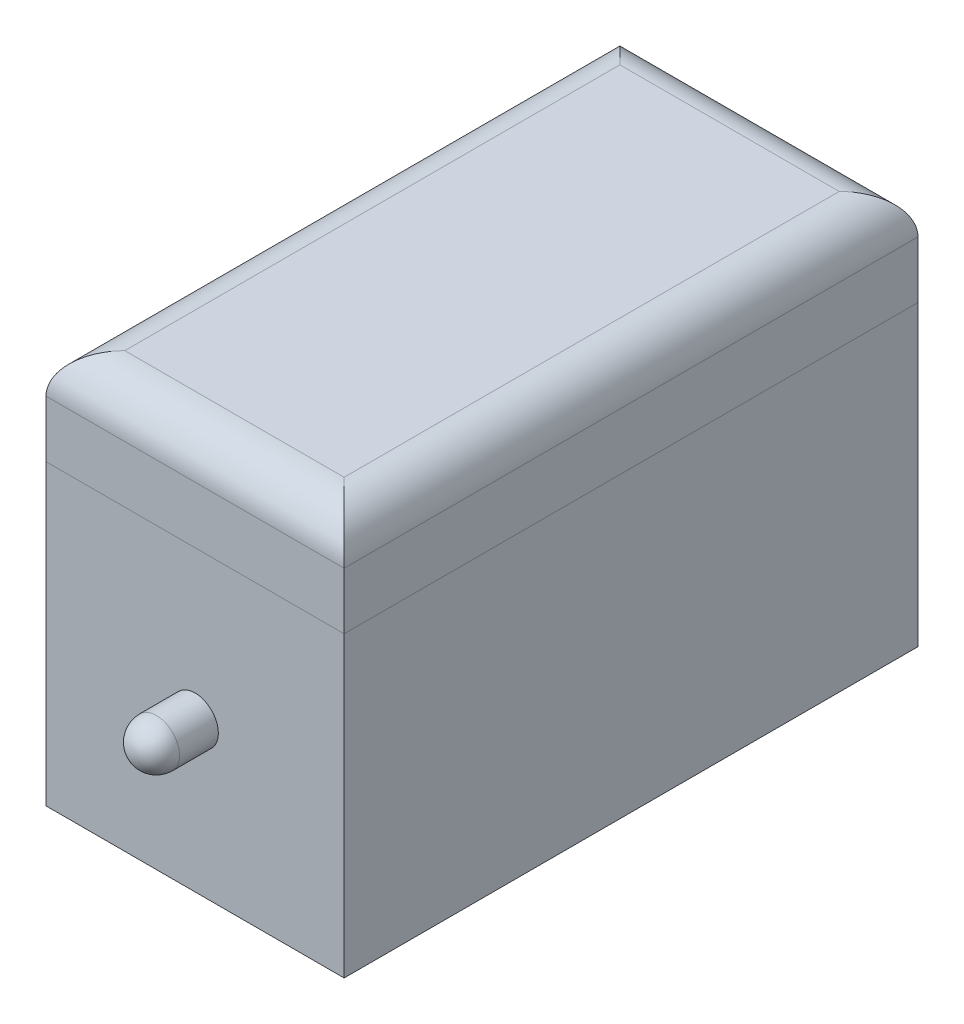
from build123d import *

# Parameters (mm, degrees)
SKETCH1_W           = 19.22
SKETCH1_H           = 19.22
BOSS_EXTRUDE1_DEPTH = 37
SKETCH3_R           = 1.5
BOSS_EXTRUDE2_DEPTH = 2.5
DOME1_FACE_RADIUS   = 1.5
DOME1_HEIGHT        = 1.5
SKETCH4_W           = 19.22
SKETCH4_H           = 37
BOSS_EXTRUDE3_DEPTH = 6.2
FILLET1_R           = 2.54


with BuildPart() as part:
    # Sketch1 → Boss-Extrude1 (new body)
    with BuildSketch(Plane.XY):
        Rectangle(SKETCH1_W, SKETCH1_H)
    extrude(amount=BOSS_EXTRUDE1_DEPTH)

    # Sketch3 → Boss-Extrude2 (add)
    with BuildSketch(Plane.XY.offset(37)):
        Circle(SKETCH3_R)
    extrude(amount=BOSS_EXTRUDE2_DEPTH)

    # Dome1: a dome of height H over a round flat face of radius A is a cap of a sphere of radius (A * A + H * H) / (2 * H)
    dome1_r = (DOME1_FACE_RADIUS * DOME1_FACE_RADIUS + DOME1_HEIGHT * DOME1_HEIGHT) / (2 * DOME1_HEIGHT)
    dome1_base = Plane((0, 0, 39.5), z_dir=(0, 0, 1))
    with Locations(dome1_base.offset(DOME1_HEIGHT - dome1_r)):
        dome1_ball = Sphere(dome1_r, mode=Mode.PRIVATE)
    add(split(dome1_ball, bisect_by=dome1_base, keep=Keep.TOP, mode=Mode.PRIVATE))


with BuildPart() as body_2:
    # Sketch4 → Boss-Extrude3 (new body)
    with BuildSketch(Plane(origin=(0, 9.61, 0), x_dir=(1, 0, 0), z_dir=(0, 1, 0))):
        with Locations((0, -18.5)):
            Rectangle(SKETCH4_W, SKETCH4_H)
    extrude(amount=BOSS_EXTRUDE3_DEPTH)

    # Fillet1
    fillet1_edges = [body_2.edges().sort_by_distance(p)[0] for p in [
        (-9.61, 15.81, 18.5),
        (0, 15.81, 37),
        (9.61, 15.81, 18.5),
        (0, 15.81, 0),
    ]]
    fillet(fillet1_edges, radius=FILLET1_R)


solid = Compound([part.part, body_2.part])
